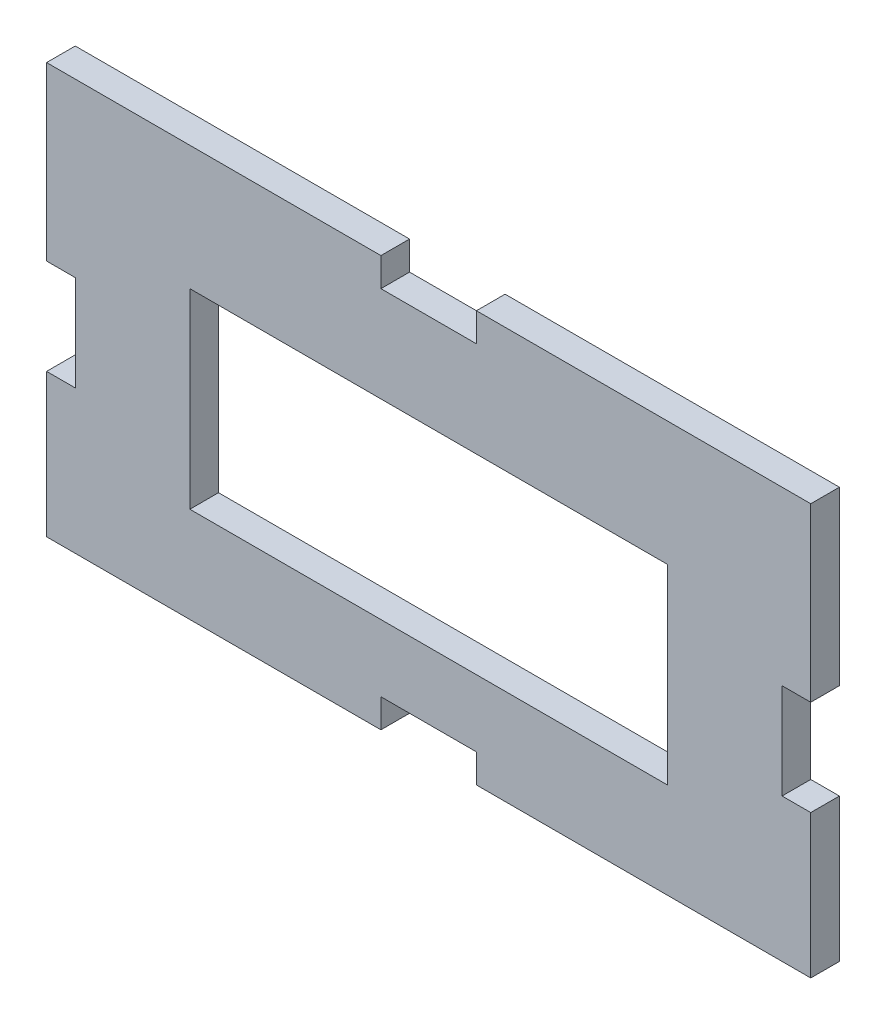
from build123d import *

# Parameters (mm, degrees)
BOSS_EXTRUDE1_DEPTH = 3
SKETCH2_W           = 50
SKETCH2_H           = 20
CUT_EXTRUDE1_DEPTH  = 10


with BuildPart() as part:
    # Sketch1 → Boss-Extrude1 (new body)
    with BuildSketch(Plane.XY):
        Polygon((-32.643571906, 0), (-32.643571906, -18), (-29.643571906, -18), (-29.643571906, -28), (-32.643571906, -28), (-32.643571906, -43), (2.356428094, -43), (2.356428094, -40), (12.356428094, -40), (12.356428094, -43), (47.356428094, -43), (47.356428094, -28), (44.356428094, -28), (44.356428094, -18), (47.356428094, -18), (47.356428094, -3), (47.356428094, 0), (12.356428094, 0), (12.356428094, -3), (2.356428094, -3), (2.356428094, 0), align=None)
    extrude(amount=BOSS_EXTRUDE1_DEPTH)

    # Sketch2 → Cut-Extrude1 (cut)
    with BuildSketch(Plane.XY.offset(3)):
        with Locations((7.356428094, -23)):
            Rectangle(SKETCH2_W, SKETCH2_H)
    extrude(amount=-CUT_EXTRUDE1_DEPTH, mode=Mode.SUBTRACT)


solid = part.part
